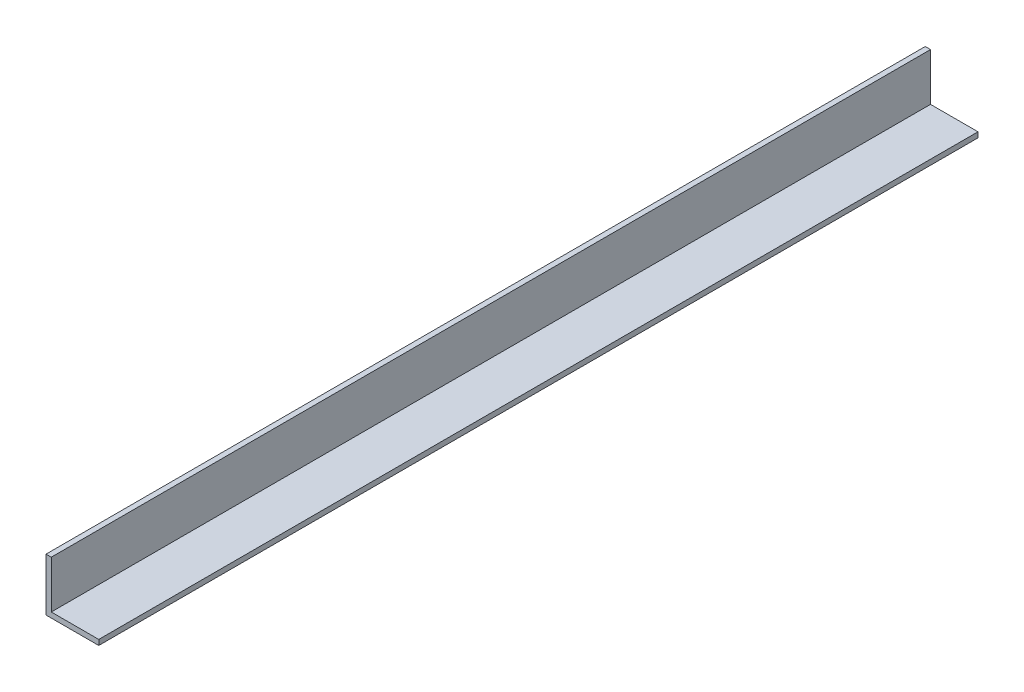
from build123d import *

# Parameters (mm, degrees)
BOSS_EXTRUDE1_DEPTH = 500


with BuildPart() as part:
    # Sketch1 → Boss-Extrude1 (new body)
    with BuildSketch(Plane.XY):
        Polygon((0, 0), (0, 30), (3, 30), (3, 3), (30, 3), (30, 0), align=None)
    extrude(amount=BOSS_EXTRUDE1_DEPTH)


solid = part.part
